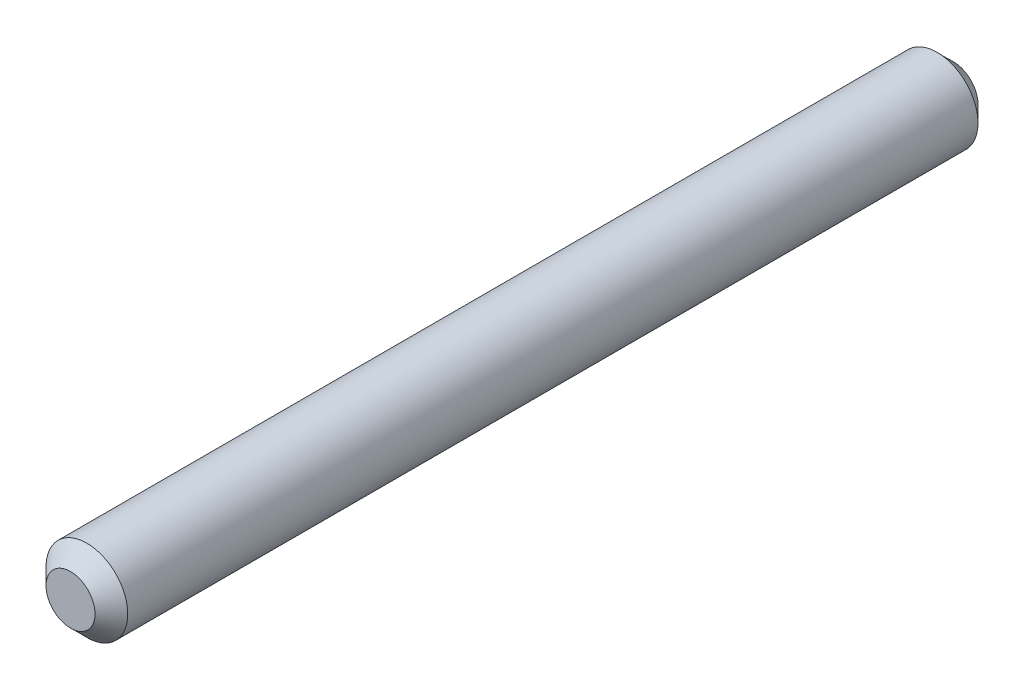
from build123d import *

# Parameters (mm, degrees)
SKETCH1_R           = 2.5
BOSS_EXTRUDE1_DEPTH = 27
CHAMFER1_SIZE       = 1


with BuildPart() as part:
    # Sketch1 → Boss-Extrude1 (new, symmetric)
    with BuildSketch(Plane.XY):
        Circle(SKETCH1_R)
    extrude(amount=BOSS_EXTRUDE1_DEPTH, both=True)

    # Chamfer1
    chamfer1_edges = [part.edges().sort_by_distance(p)[0] for p in [
        (-2.5, 0, -27),
        (-2.5, 0, 27),
    ]]
    chamfer(chamfer1_edges, length=CHAMFER1_SIZE)


solid = part.part
